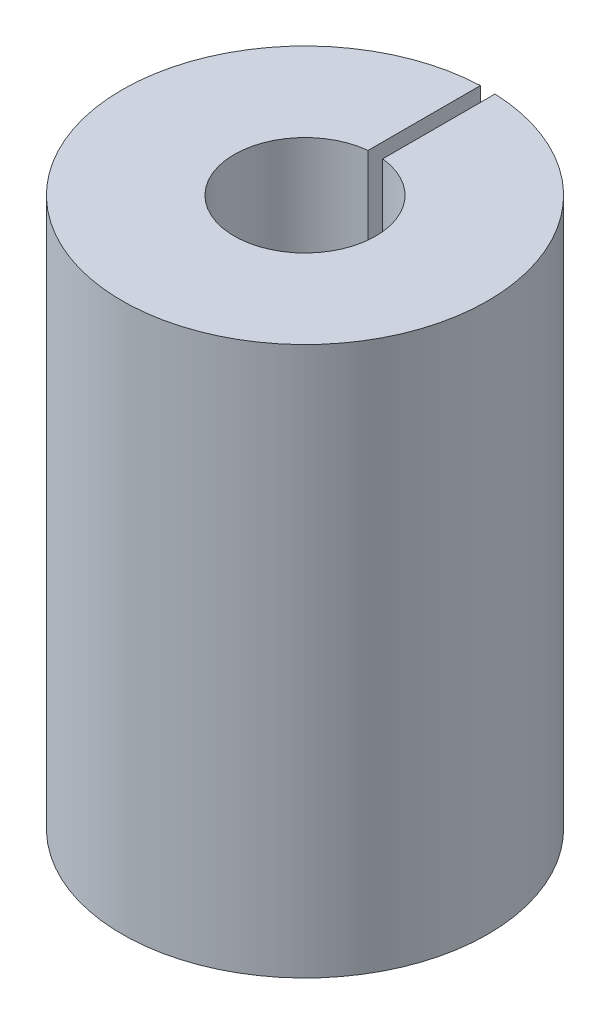
from build123d import *

# Parameters (mm, degrees)
SKETCH1_R                    = 6.35
BOSS_EXTRUDE1_DEPTH          = 19.05
F_10_0_1935_DIAMETER_HOLE2_D = 4.9149
CUT_EXTRUDE1_DEPTH           = 33.808987893


with BuildPart() as part:
    # Sketch1 → Boss-Extrude1 (new body)
    with BuildSketch(Plane(origin=(0, 0, 0), x_dir=(1, 0, 0), z_dir=(0, 1, 0))):
        with Locations(Location((-18.175558327, 4.234147358, 0), (0, 0, 90))):
            Circle(SKETCH1_R)
    extrude(amount=BOSS_EXTRUDE1_DEPTH)

    # #10 (0.1935) Diameter Hole2 (through all)
    with Locations(Plane(origin=(0, 19.05, 0), x_dir=(1, 0, 0), z_dir=(0, 1, 0))):
        with Locations((-18.175558327, 4.234147358)):
            Hole(F_10_0_1935_DIAMETER_HOLE2_D / 2)

    # Sketch6 → Cut-Extrude1 (cut, through all)
    with BuildSketch(Plane(origin=(0, 19.05, 0), x_dir=(1, 0, 0), z_dir=(0, 1, 0))):
        with BuildLine():
            Line((-18.429558327, 10.579065324), (-18.429558327, 6.678435496))
            ThreePointArc((-18.429558327, 6.678435496), (-18.175558327, 6.691597358), (-17.921558327, 6.678435496))
            Line((-17.921558327, 6.678435496), (-17.921558327, 10.579065324))
            ThreePointArc((-17.921558327, 10.579065324), (-18.175558327, 10.584147358), (-18.429558327, 10.579065324))
        make_face()
    extrude(amount=-CUT_EXTRUDE1_DEPTH, mode=Mode.SUBTRACT)


solid = part.part
